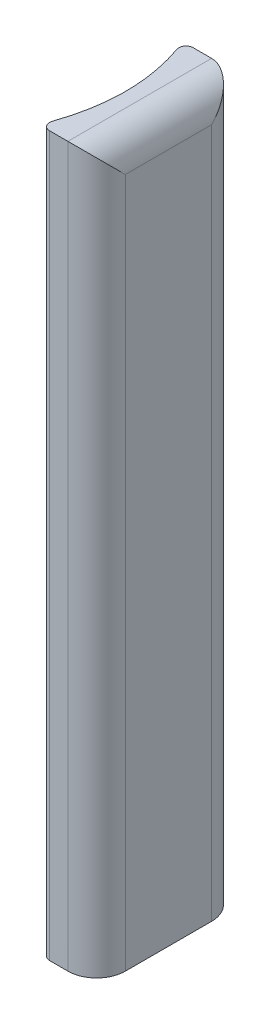
from build123d import *

# Parameters (mm, degrees)
BOSS_EXTRUDE1_DEPTH      = 5
BOSS_EXTRUDE1_DEPTH_BACK = 5
SKETCH1_W                = 4
SKETCH1_H                = 50
CUT_EXTRUDE1_DEPTH       = 60
FILLET2_R                = 2
FILLET3_R                = 0.5


with BuildPart() as part:
    # Sketch1 → Boss-Extrude1 (new, two sides: drawn at the far end of the back side and taken through both)
    with BuildSketch(Plane.XY.offset(-BOSS_EXTRUDE1_DEPTH_BACK)):
        Rectangle(SKETCH1_W, SKETCH1_H)
    extrude(amount=BOSS_EXTRUDE1_DEPTH + BOSS_EXTRUDE1_DEPTH_BACK)

    # Sketch2 → Cut-Extrude1 (cut)
    with BuildSketch(Plane(origin=(0, 25, 0), x_dir=(1, 0, 0), z_dir=(0, 1, 0))):
        with BuildLine():
            Line((-2, 5), (-2, -5))
            add(Edge.make_bspline(
                [(-2, -5), (0, 0), (-2, 5)],
                knots=[0.5, 0.5, 0.5, 1.5, 1.5, 1.5], degree=2))
        make_face()
    extrude(amount=-CUT_EXTRUDE1_DEPTH, mode=Mode.SUBTRACT)

    # Fillet2
    fillet2_edges = [part.edges().sort_by_distance(p)[0] for p in [
        (2, 0, -5),
        (2, 25, 0),
        (2, 0, 5),
    ]]
    fillet(fillet2_edges, radius=FILLET2_R)

    # Fillet3
    fillet3_edges = [part.edges().sort_by_distance(p)[0] for p in [
        (-2, 0, -5),
        (-2, 0, 5),
    ]]
    fillet(fillet3_edges, radius=FILLET3_R)


solid = part.part
